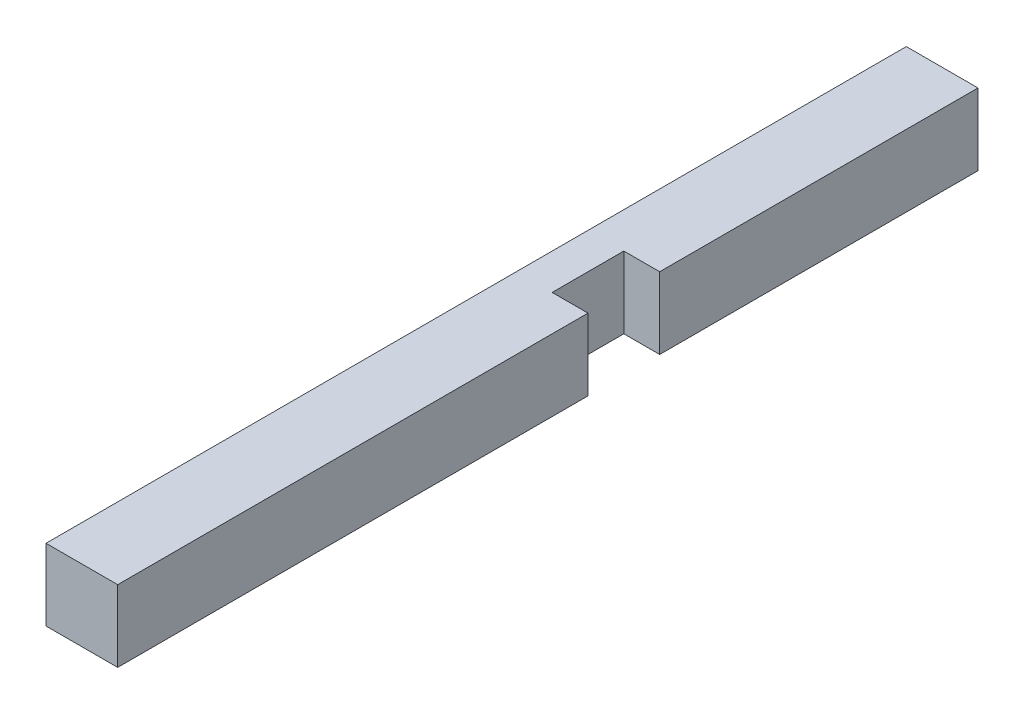
from build123d import *

# Parameters (mm, degrees)
ESQUISSE1_W             = 10
ESQUISSE1_H             = 10
BOSS_EXTRU_1_DEPTH      = 120
ESQUISSE2_W             = 5
ESQUISSE2_H             = 10
ENL_V_MAT_EXTRU_1_DEPTH = 121.830459736


with BuildPart() as part:
    # Esquisse1 → Boss.-Extru.1 (new body)
    with BuildSketch(Plane.XY):
        with Locations((5, 5)):
            Rectangle(ESQUISSE1_W, ESQUISSE1_H)
    extrude(amount=BOSS_EXTRU_1_DEPTH)

    # Esquisse2 → Enlèv. mat.-Extru.1 (cut, through all)
    with BuildSketch(Plane(origin=(0, 10, 0), x_dir=(1, 0, 0), z_dir=(0, 1, 0))):
        with Locations((7.5, -49.4)):
            Rectangle(ESQUISSE2_W, ESQUISSE2_H)
    extrude(amount=-ENL_V_MAT_EXTRU_1_DEPTH, mode=Mode.SUBTRACT)


solid = part.part
